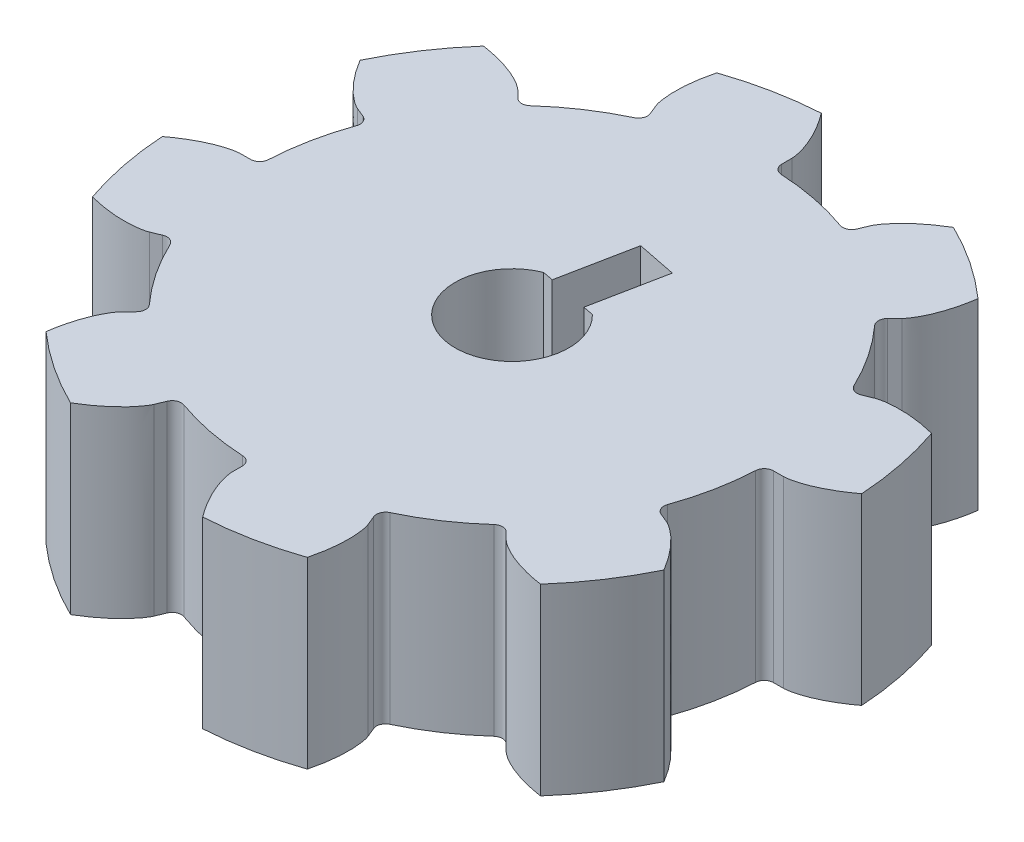
from build123d import *

# Parameters (mm, degrees)
SKETCH_4_R                       = 14
EXTRUDE_1_DEPTH                  = 10
EXTRUDE_2_DEPTH                  = 10
FILLET_1_R                       = 0.5
PATTERN_CIRCULAR_1_COUNT         = 8
FILLET_1_OF_PATTERN_CIRCULAR_1_R = 0.5
CUT_EXTRUDE_1_DEPTH              = 28.30524858


with BuildPart() as part:
    # ｽｹｯﾁ4 → ﾎﾞｽ - 押し出し1 (new body)
    with BuildSketch(Plane(origin=(0, 0, 0), x_dir=(1, 0, 0), z_dir=(0, 1, 0))):
        with Locations(Location((0, 0, 0), (0, 0, 270))):
            Circle(SKETCH_4_R)
    extrude(amount=EXTRUDE_1_DEPTH)

    # ｽｹｯﾁ3 → ﾎﾞｽ - 押し出し2 (add)
    with BuildSketch(Plane(origin=(0, 0, 0), x_dir=(1, 0, 0), z_dir=(0, 1, 0))):
        with BuildLine():
            Line((0.224080336, 15.033412012), (0.224080336, 13.9982066))
            ThreePointArc((0.224080336, 13.9982066), (-2.731264508, 13.730993926), (-5.563904985, 12.846904737))
            Line((-5.563904985, 12.846904737), (-5.960060945, 13.80330983))
            add(Edge.make_bspline(
                [(-5.858426114, 17.019954273), (-5.920939237, 16.775820636), (-6.005177259, 16.385669184), (-6.081389407, 15.859669081), (-6.117456435, 15.463573167), (-6.130866377, 15.108674888), (-6.126107546, 14.796141282), (-6.107718221, 14.526781883), (-6.080279115, 14.301036558), (-6.048330179, 14.119000945), (-6.01650055, 13.980359087), (-5.987708331, 13.879742422), (-5.969195203, 13.825538164), (-5.960060945, 13.80330983)],
                knots=[0, 0, 0, 0, 0.232146242, 0.367277189, 0.48933989, 0.598334347, 0.694260559, 0.777118527, 0.846908252, 0.903629737, 0.947282983, 0.977868, 1, 1, 1, 1], degree=3))
            ThreePointArc((-5.858426114, 17.019954273), (-3.511625796, 17.654135047), (-1.10077454, 17.966310011))
            add(Edge.make_bspline(
                [(-1.10077454, 17.966310011), (-0.949594047, 17.764682676), (-0.722463767, 17.436466231), (-0.450761398, 16.979670628), (-0.265860465, 16.627527975), (-0.117657603, 16.304776481), (-0.002452756, 16.014211953), (0.083637102, 15.758319028), (0.14467567, 15.539257051), (0.184820715, 15.358851746), (0.208469915, 15.218582699), (0.220373703, 15.114606716), (0.224012874, 15.057443845), (0.224080336, 15.033412012)],
                knots=[0, 0, 0, 0, 0.232146242, 0.367277189, 0.48933989, 0.598334347, 0.694260559, 0.777118527, 0.846908252, 0.903629737, 0.947282983, 0.977868, 1, 1, 1, 1], degree=3))
        make_face()
    extrude_2 = extrude(amount=EXTRUDE_2_DEPTH)

    # ﾌｨﾚｯﾄ1
    fillet_1_edges = [part.edges().sort_by_distance(p)[0] for p in [
        (-5.563904985, 5, -12.846904737),
        (0.224080336, 5, -13.9982066),
    ]]
    fillet(fillet_1_edges, radius=FILLET_1_R)

    # 円形ﾊﾟﾀｰﾝ1: ﾎﾞｽ - 押し出し2 ×8 about axis
    pattern_circular_1_axis = Axis((0, 10, 0), (0, 1, 0))
    for i in range(1, PATTERN_CIRCULAR_1_COUNT):
        add(extrude_2.rotate(pattern_circular_1_axis, i * 360 / PATTERN_CIRCULAR_1_COUNT))

    # ﾌｨﾚｯﾄ1 of 円形ﾊﾟﾀｰﾝ1
    fillet_1_of_pattern_circular_1_edges = [part.edges().sort_by_distance(p)[0] for p in [
        (-13.018408401, 5, -5.149858512),
        (-9.739778086, 5, -10.056675536),
        (-12.846904737, 5, 5.563904985),
        (-13.9982066, 5, -0.224080336),
        (-5.149858512, 5, 13.018408401),
        (-10.056675536, 5, 9.739778086),
        (5.563904985, 5, 12.846904737),
        (-0.224080336, 5, 13.9982066),
        (13.018408401, 5, 5.149858512),
        (9.739778086, 5, 10.056675536),
        (12.846904737, 5, -5.563904985),
        (13.9982066, 5, 0.224080336),
        (5.149858512, 5, -13.018408401),
        (10.056675536, 5, -9.739778086),
    ]]
    fillet(fillet_1_of_pattern_circular_1_edges, radius=FILLET_1_OF_PATTERN_CIRCULAR_1_R)

    # ｽｹｯﾁ5 → ｶｯﾄ - 押し出し1 (cut, through all)
    with BuildSketch(Plane(origin=(0, 10, 0), x_dir=(1, 0, 0), z_dir=(0, 1, 0))):
        with BuildLine():
            Line((-1.148521284, 2.879392099), (-0.571628971, 2.764641083))
            Line((-0.571628971, 2.764641083), (0.228241349, 6.785860733))
            Line((0.228241349, 6.785860733), (2.385968966, 6.356662024))
            Line((2.385968966, 6.356662024), (1.586098646, 2.335442375))
            Line((1.586098646, 2.335442375), (2.162990959, 2.220691359))
            ThreePointArc((2.162990959, 2.220691359), (-0.604779998, -3.040434369), (-1.148521284, 2.879392099))
        make_face()
    extrude(amount=-CUT_EXTRUDE_1_DEPTH, mode=Mode.SUBTRACT)


solid = part.part
